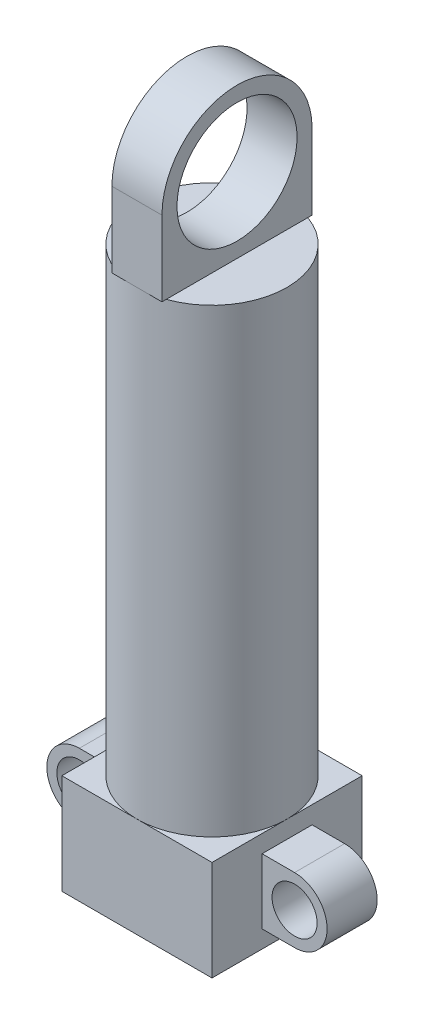
from build123d import *

# Parameters (mm, degrees)
SKETCH1_R           = 7.5
BOSS_EXTRUDE1_DEPTH = 46
SKETCH2_W           = 15
SKETCH2_H           = 15
BOSS_EXTRUDE2_DEPTH = 10
BOSS_EXTRUDE3_DEPTH = 15
CUT_EXTRUDE4_DEPTH  = 64.263338514
SKETCH6_R           = 6
CUT_EXTRUDE5_DEPTH  = 64.263338514
SKETCH7_R           = 6
CUT_EXTRUDE6_DEPTH  = 5
CUT_EXTRUDE7_START  = -5
CUT_EXTRUDE7_DEPTH  = 5
SKETCH11_R          = 3.25
SKETCH11_R_2        = 2.25
BOSS_EXTRUDE4_DEPTH = 2.5
BOSS_EXTRUDE5_DEPTH = 2.5


with BuildPart() as part:
    # Sketch1 → Boss-Extrude1 (new body)
    with BuildSketch(Plane(origin=(0, 0, 0), x_dir=(1, 0, 0), z_dir=(0, 1, 0))):
        with Locations(Location((0, 0, 0), (0, 0, 270))):
            Circle(SKETCH1_R)
    extrude(amount=BOSS_EXTRUDE1_DEPTH)

    # Sketch2 → Boss-Extrude2 (add)
    with BuildSketch(Plane.XZ):
        Rectangle(SKETCH2_W, SKETCH2_H)
    extrude(amount=BOSS_EXTRUDE2_DEPTH)

    # Sketch4 → Boss-Extrude3 (add)
    with BuildSketch(Plane(origin=(0, 46, 0), x_dir=(1, 0, 0), z_dir=(0, 1, 0))):
        Polygon((0, 7.5), (7.5, 7.5), (7.5, -7.5), (-7.5, -7.5), (-7.5, 7.5), align=None)
    extrude(amount=BOSS_EXTRUDE3_DEPTH)

    # Sketch5 → Cut-Extrude4 (cut, through all)
    with BuildSketch(Plane.ZY.offset(7.5)):
        with BuildLine():
            ThreePointArc((-7.5, 53.5), (-5.303300859, 58.803300859), (0, 61))
            Line((0, 61), (-7.5, 61))
            Line((-7.5, 61), (-7.5, 53.5))
        make_face()
        with BuildLine():
            Line((7.5, 61), (0, 61))
            ThreePointArc((0, 61), (5.303300859, 58.803300859), (7.5, 53.5))
            Line((7.5, 53.5), (7.5, 61))
        make_face()
    extrude(amount=-CUT_EXTRUDE4_DEPTH, mode=Mode.SUBTRACT)

    # Sketch6 → Cut-Extrude5 (cut, through all)
    with BuildSketch(Plane.ZY.offset(7.5)):
        with Locations((0, 53.5)):
            Circle(SKETCH6_R)
    extrude(amount=-CUT_EXTRUDE5_DEPTH, mode=Mode.SUBTRACT)

    # Sketch7 → Cut-Extrude6 (cut)
    # profile 1 of 4: a face of its own
    with BuildSketch(Plane.ZY.offset(7.5)):
        with BuildLine():
            ThreePointArc((0, 46), (-5.303300859, 48.196699141), (-7.5, 53.5))
            Line((-7.5, 53.5), (-7.5, 46))
            Line((-7.5, 46), (0, 46))
        make_face()
    # profile 2 of 4: a face of its own
    with BuildSketch(Plane.ZY.offset(7.5)):
        with BuildLine():
            Line((7.5, 46), (7.5, 53.5))
            ThreePointArc((7.5, 53.5), (5.303300859, 48.196699141), (0, 46))
            Line((0, 46), (7.5, 46))
        make_face()
    # profile 3 of 4: a face of its own
    with BuildSketch(Plane.ZY.offset(7.5)):
        with BuildLine():
            ThreePointArc((7.5, 53.5), (0, 61), (-7.5, 53.5))
            ThreePointArc((-7.5, 53.5), (-5.303300859, 48.196699141), (0, 46))
            ThreePointArc((0, 46), (5.303300859, 48.196699141), (7.5, 53.5))
        make_face()
        with Locations((0, 53.5)):
            Circle(SKETCH7_R, mode=Mode.SUBTRACT)
    # profile 4 of 4: a face of its own
    with BuildSketch(Plane.ZY.offset(7.5)):
        with Locations((0, 53.5)):
            Circle(SKETCH7_R)
    extrude(amount=-CUT_EXTRUDE6_DEPTH, mode=Mode.SUBTRACT)

    # Sketch10 → Cut-Extrude7 (cut)
    with BuildSketch(Plane(origin=(7.5, 0, 0), x_dir=(0, 0, -1), z_dir=(1, 0, 0)).offset(CUT_EXTRUDE7_START)):
        with BuildLine():
            Line((7.5, 53.5), (6, 53.5))
            ThreePointArc((6, 53.5), (0, 47.5), (-6, 53.5))
            Line((-6, 53.5), (-7.5, 53.5))
            Line((-7.5, 53.5), (-7.5, 46))
            Line((-7.5, 46), (0, 46))
            Line((0, 46), (7.5, 46))
            Line((7.5, 46), (7.5, 53.5))
        make_face()
        with BuildLine():
            ThreePointArc((-6, 53.5), (0, 59.5), (6, 53.5))
            Line((6, 53.5), (7.5, 53.5))
            ThreePointArc((7.5, 53.5), (0, 61), (-7.5, 53.5))
            Line((-7.5, 53.5), (-6, 53.5))
        make_face()
    extrude(amount=CUT_EXTRUDE7_DEPTH, mode=Mode.SUBTRACT)

    # Sketch11 → Boss-Extrude4 (add, symmetric)
    # profile 1 of 3: a face of its own
    with BuildSketch(Plane(origin=(0, 0, 0), x_dir=(-1, 0, 0), z_dir=(0, 0, -1))):
        with BuildLine():
            Line((7.5, -1.75), (7.5, -5))
            ThreePointArc((7.5, -5), (8.451902961, -2.701902961), (10.75, -1.75))
            Line((10.75, -1.75), (7.5, -1.75))
        make_face()
    # profile 2 of 3: a face of its own
    with BuildSketch(Plane(origin=(0, 0, 0), x_dir=(-1, 0, 0), z_dir=(0, 0, -1))):
        with BuildLine():
            Line((7.5, -5), (7.5, -8.25))
            Line((7.5, -8.25), (10.75, -8.25))
            ThreePointArc((10.75, -8.25), (8.451902961, -7.298097039), (7.5, -5))
        make_face()
    # profile 3 of 3: a face of its own
    with BuildSketch(Plane(origin=(0, 0, 0), x_dir=(-1, 0, 0), z_dir=(0, 0, -1))):
        with Locations((10.75, -5)):
            Circle(SKETCH11_R)
        with Locations((10.75, -5)):
            Circle(SKETCH11_R_2, mode=Mode.SUBTRACT)
    extrude(amount=BOSS_EXTRUDE4_DEPTH, both=True)

    # Sketch12 → Boss-Extrude5 (add, symmetric)
    with BuildSketch(Plane(origin=(0, 0, 0), x_dir=(-1, 0, 0), z_dir=(0, 0, -1))):
        with BuildLine():
            Line((-7.5, -8.25), (-7.5, -5))
            ThreePointArc((-7.5, -5), (-8.451902961, -7.298097039), (-10.75, -8.25))
            Line((-10.75, -8.25), (-7.5, -8.25))
        make_face()
        with BuildLine():
            Line((-7.5, -5), (-7.5, -1.75))
            Line((-7.5, -1.75), (-10.75, -1.75))
            ThreePointArc((-10.75, -1.75), (-8.451902961, -2.701902961), (-7.5, -5))
        make_face()
        with BuildLine():
            ThreePointArc((-7.5, -5), (-8.451902961, -2.701902961), (-10.75, -1.75))
            Line((-10.75, -1.75), (-10.75, -2.75))
            ThreePointArc((-10.75, -2.75), (-9.159009742, -3.409009742), (-8.5, -5))
            Line((-8.5, -5), (-7.5, -5))
        make_face()
        with BuildLine():
            ThreePointArc((-10.75, -8.25), (-8.451902961, -7.298097039), (-7.5, -5))
            Line((-7.5, -5), (-8.5, -5))
            ThreePointArc((-8.5, -5), (-9.159009742, -6.590990258), (-10.75, -7.25))
            Line((-10.75, -7.25), (-10.75, -8.25))
        make_face()
        with BuildLine():
            Line((-10.75, -2.75), (-10.75, -1.75))
            ThreePointArc((-10.75, -1.75), (-14, -5), (-10.75, -8.25))
            Line((-10.75, -8.25), (-10.75, -7.25))
            ThreePointArc((-10.75, -7.25), (-13, -5), (-10.75, -2.75))
        make_face()
    extrude(amount=BOSS_EXTRUDE5_DEPTH, both=True)


solid = part.part
